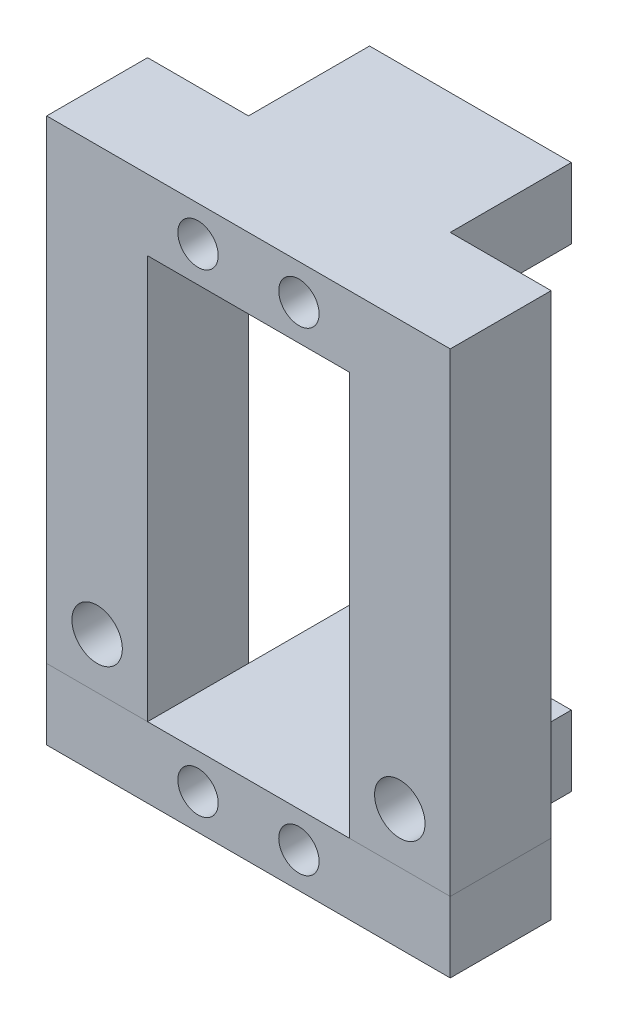
from build123d import *

# Parameters (mm, degrees)
SKETCH_1_W          = 10
SKETCH_1_H          = 10
SKETCH_1_R          = 2.5
EXTRUDE_2_DEPTH     = 10
EXTRUDE_2_2_DEPTH   = 10
SKETCH_2_W          = 40
SKETCH_2_H          = 7
EXTRUDE_3_DEPTH     = 10
SKETCH_3_W          = 20
SKETCH_3_H          = 7
EXTRUDE_4_DEPTH     = 12
SKETCH_4_R          = 2
CUT_EXTRUDE_1_DEPTH = 33.062439084
SKETCH_5_W          = 10
SKETCH_5_H          = 10
EXTRUDE_5_DEPTH     = 30
SKETCH_6_W          = 20
SKETCH_6_H          = 12
SKETCH_6_W_2        = 10
SKETCH_6_H_2        = 10
EXTRUDE_6_DEPTH     = 7
SKETCH_7_R          = 2
CUT_EXTRUDE_2_DEPTH = 52.458721321


with BuildPart() as part:
    # Эскиз1 → Бобышка-Вытянуть2 (new body)
    with BuildSketch(Plane.XY):
        with Locations((-15, 0)):
            Rectangle(SKETCH_1_W, SKETCH_1_H)
        with Locations((-15, 0)):
            Circle(SKETCH_1_R, mode=Mode.SUBTRACT)
    extrude(amount=EXTRUDE_2_DEPTH)



with BuildPart() as body_2:
    # Эскиз1 → Extrude 2 2 (new body)
    with BuildSketch(Plane.XY):
        with Locations((15, 0)):
            Rectangle(SKETCH_1_W, SKETCH_1_H)
        with Locations((15, 0)):
            Circle(SKETCH_1_R, mode=Mode.SUBTRACT)
    extrude(amount=EXTRUDE_2_2_DEPTH)


with BuildPart() as body_3:
    # Эскиз2 → Бобышка-Вытянуть3 (new body)
    with BuildSketch(Plane.XY):
        with Locations((0, -8.5)):
            Rectangle(SKETCH_2_W, SKETCH_2_H)
    extrude(amount=EXTRUDE_3_DEPTH)

    # Эскиз3 → Бобышка-Вытянуть4 (add)
    with BuildSketch(Plane(origin=(0, 0, 0), x_dir=(-1, 0, 0), z_dir=(0, 0, -1))):
        with Locations((0, -8.5)):
            Rectangle(SKETCH_3_W, SKETCH_3_H)
    extrude(amount=EXTRUDE_4_DEPTH)

    # Эскиз4 → Вырез-Вытянуть1 (cut, through all)
    with BuildSketch(Plane(origin=(0, 0, -12), x_dir=(-1, 0, 0), z_dir=(0, 0, -1))):
        with Locations((-5, -8.5)):
            Circle(SKETCH_4_R)
        with Locations((5, -8.5)):
            Circle(SKETCH_4_R)
    extrude(amount=-CUT_EXTRUDE_1_DEPTH, mode=Mode.SUBTRACT)


with BuildPart() as part_1:
    add(part.part)

    add(body_2.part)  # Бобышка-Вытянуть5 merges body 2
    # Эскиз5 → Бобышка-Вытянуть5 (add)
    with BuildSketch(Plane(origin=(0, 5, 0), x_dir=(1, 0, 0), z_dir=(0, 1, 0))):
        with Locations((-15, -5)):
            Rectangle(SKETCH_5_W, SKETCH_5_H)
        with Locations((15, -5)):
            Rectangle(SKETCH_5_W, SKETCH_5_H)
    extrude(amount=EXTRUDE_5_DEPTH)

    # Эскиз6 → Бобышка-Вытянуть6 (add)
    with BuildSketch(Plane(origin=(0, 35, 0), x_dir=(1, 0, 0), z_dir=(0, 1, 0))):
        with Locations((0, 6)):
            Rectangle(SKETCH_6_W, SKETCH_6_H)
        Polygon((-10, 0), (-20, 0), (-20, -10), (10, -10), (10, 0), align=None)
        with Locations((15, -5)):
            Rectangle(SKETCH_6_W_2, SKETCH_6_H_2)
    extrude(amount=EXTRUDE_6_DEPTH)

    # Эскиз7 → Вырез-Вытянуть2 (cut, through all)
    with BuildSketch(Plane(origin=(0, 0, -12), x_dir=(-1, 0, 0), z_dir=(0, 0, -1))):
        with Locations(Location((-5, 38.5, 0), (0, 0, 90))):
            Circle(SKETCH_7_R)
        with Locations(Location((5, 38.5, 0), (0, 0, 90))):
            Circle(SKETCH_7_R)
    extrude(amount=-CUT_EXTRUDE_2_DEPTH, mode=Mode.SUBTRACT)


solid = Compound([body_3.part, part_1.part])
